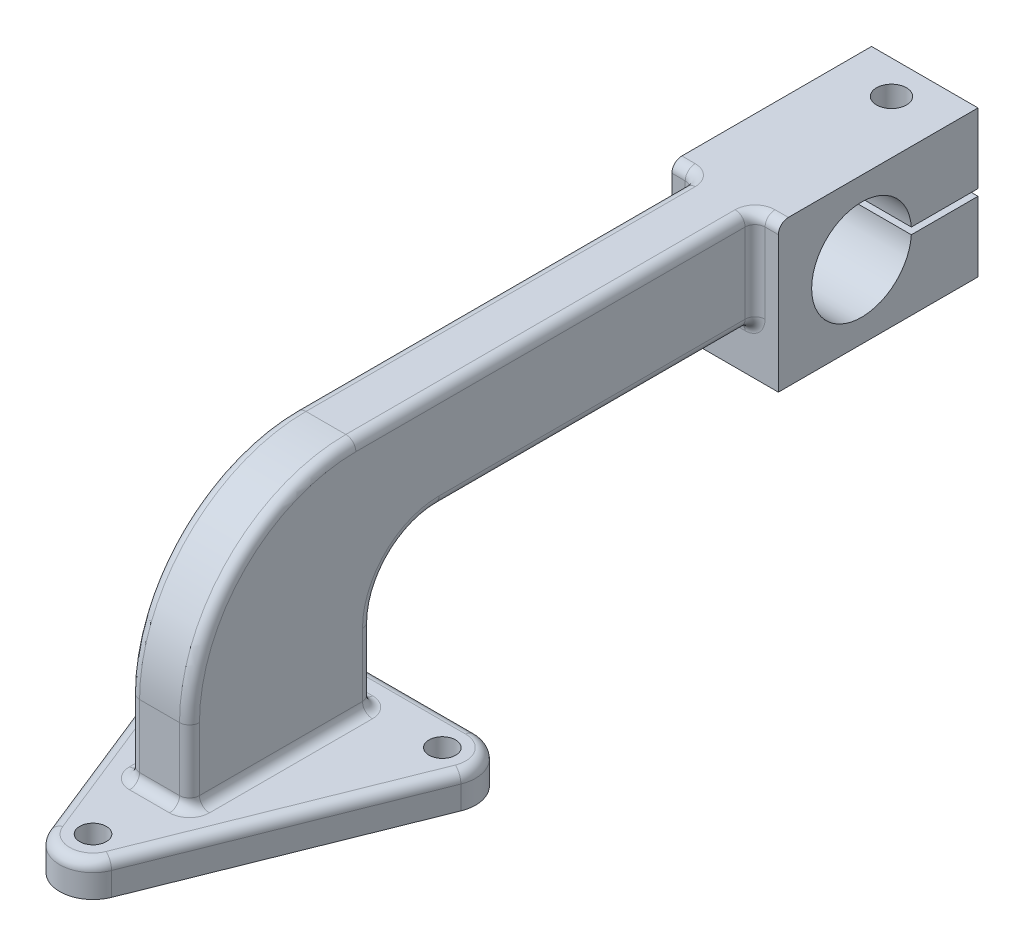
from build123d import *

# Parameters (mm, degrees)
BOSS_EXTRUDE1_DEPTH = 9
SKETCH2_W           = 32
SKETCH2_H           = 44
BOSS_EXTRUDE2_DEPTH = 60
SKETCH3_R           = 15
CUT_EXTRUDE1_DEPTH  = 60
SKETCH4_W           = 34.378885512
SKETCH4_H           = 2
CUT_EXTRUDE2_DEPTH  = 162.300673762
SKETCH5_R           = 4.5
CUT_EXTRUDE3_DEPTH  = 168.593584979
SKETCH6_R           = 4
BOSS_EXTRUDE3_DEPTH = 10
FILLET1_R           = 3


with BuildPart() as part:
    # Sketch1 → Boss-Extrude1 (new, symmetric)
    with BuildSketch(Plane(origin=(0, 0, 0), x_dir=(0, 0, -1), z_dir=(1, 0, 0))):
        with BuildLine():
            Line((90.49122807, -6.438596491), (-4.50877193, -6.438596491))
            ThreePointArc((-4.50877193, -6.438596491), (-18.650907554, -12.296460867), (-24.50877193, -26.438596491))
            Line((-24.50877193, -26.438596491), (-24.50877193, -48.438596491))
            Line((-24.50877193, -48.438596491), (-79.50877193, -48.438596491))
            Line((-79.50877193, -48.438596491), (-79.50877193, -37.438596491))
            Line((-79.50877193, -37.438596491), (-79.50877193, -26.438596491))
            ThreePointArc((-79.50877193, -26.438596491), (-64.864110989, 8.916742568), (-29.50877193, 23.561403509))
            Line((-29.50877193, 23.561403509), (90.49122807, 23.561403509))
            Line((90.49122807, 23.561403509), (90.49122807, -6.438596491))
        make_face()
    extrude(amount=BOSS_EXTRUDE1_DEPTH, both=True)

    # Sketch2 → Boss-Extrude2 (add)
    with BuildSketch(Plane(origin=(0, 0, -90.49122807), x_dir=(-1, 0, 0), z_dir=(0, 0, -1))):
        with Locations((0, 1.561403509)):
            Rectangle(SKETCH2_W, SKETCH2_H)
    extrude(amount=BOSS_EXTRUDE2_DEPTH)

    # Sketch3 → Cut-Extrude1 (cut)
    with BuildSketch(Plane(origin=(16, 0, 0), x_dir=(0, 0, -1), z_dir=(1, 0, 0))):
        with Locations((115.49122807, 1.561403509)):
            Circle(SKETCH3_R)
    extrude(amount=-CUT_EXTRUDE1_DEPTH, mode=Mode.SUBTRACT)

    # Sketch4 → Cut-Extrude2 (cut, through all)
    with BuildSketch(Plane(origin=(16, 0, 0), x_dir=(0, 0, -1), z_dir=(1, 0, 0))):
        with Locations((143.677522108, 1.561403509)):
            Rectangle(SKETCH4_W, SKETCH4_H)
    extrude(amount=-CUT_EXTRUDE2_DEPTH, mode=Mode.SUBTRACT)

    # Sketch5 → Cut-Extrude3 (cut, through all)
    with BuildSketch(Plane(origin=(0, 23.561403509, 0), x_dir=(1, 0, 0), z_dir=(0, 1, 0))):
        with Locations(Location((0, 140.49122807, 0), (0, 0, 270))):
            Circle(SKETCH5_R)
    extrude(amount=-CUT_EXTRUDE3_DEPTH, mode=Mode.SUBTRACT)

    # Sketch6 → Boss-Extrude3 (add)
    with BuildSketch(Plane.XZ.offset(48.438596491)):
        with BuildLine():
            Line((-30, 14.50877193), (30, 14.50877193))
            ThreePointArc((30, 14.50877193), (38.280672305, 18.902483837), (39.284766909, 28.222678693))
            Line((39.284766909, 28.222678693), (9.284766909, 103.222678693))
            ThreePointArc((9.284766909, 103.222678693), (0, 109.50877193), (-9.284766909, 103.222678693))
            Line((-9.284766909, 103.222678693), (-39.284766909, 28.222678693))
            ThreePointArc((-39.284766909, 28.222678693), (-38.280672305, 18.902483837), (-30, 14.50877193))
        make_face()
        with Locations(Location((30, 24.50877193, 0), (0, 0, 270))):
            Circle(SKETCH6_R, mode=Mode.SUBTRACT)
        with Locations(Location((-30, 24.50877193, 0), (0, 0, 270))):
            Circle(SKETCH6_R, mode=Mode.SUBTRACT)
        with Locations(Location((0, 99.50877193, 0), (0, 0, 270))):
            Circle(SKETCH6_R, mode=Mode.SUBTRACT)
    extrude(amount=BOSS_EXTRUDE3_DEPTH)

    # Fillet1
    fillet1_edges = [part.edges().sort_by_distance(p)[0] for p in [
        (9, 8.916742568, 64.864110989),
        (-9, -37.438596491, 79.50877193),
        (-9, 8.916742568, 64.864110989),
        (-9, 23.561403509, -30.49122807),
        (-9, 8.561403509, -90.49122807),
        (-38.280672305, -48.438596491, 18.902483837),
        (0, -48.438596491, 14.50877193),
        (38.280672305, -48.438596491, 18.902483837),
        (24.284766909, -48.438596491, 65.722678693),
        (0, -48.438596491, 109.50877193),
        (-24.284766909, -48.438596491, 65.722678693),
        (9, -37.438596491, 79.50877193),
        (0, -6.438596491, -90.49122807),
        (0, -48.438596491, 24.50877193),
        (0, -48.438596491, 79.50877193),
        (9, -48.438596491, 52.00877193),
        (9, -37.438596491, 24.50877193),
        (9, -12.296460867, 18.650907554),
        (9, -6.438596491, -42.99122807),
        (-12.5, 23.561403509, -90.49122807),
        (12.5, 23.561403509, -90.49122807),
        (9, 8.561403509, -90.49122807),
        (9, 23.561403509, -30.49122807),
        (-9, -6.438596491, -42.99122807),
        (-9, -12.296460867, 18.650907554),
        (-9, -37.438596491, 24.50877193),
        (-9, -48.438596491, 52.00877193),
    ]]
    fillet(fillet1_edges, radius=FILLET1_R)


solid = part.part
